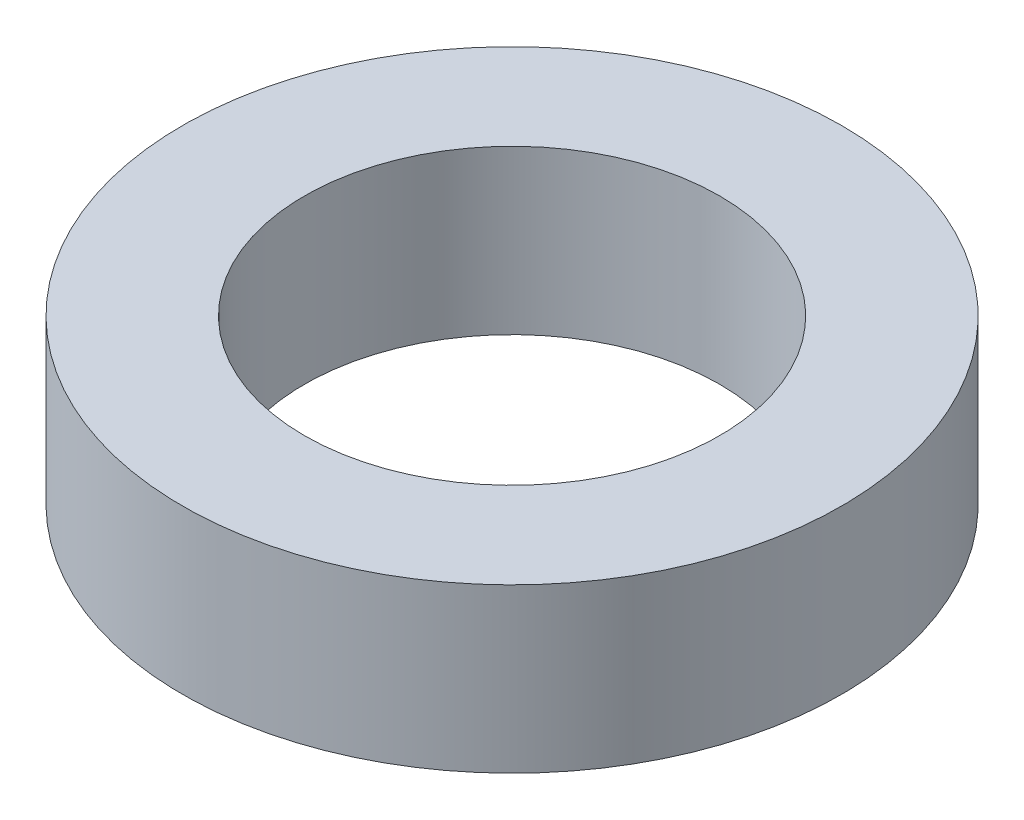
from build123d import *

# Parameters (mm, degrees)
SKETCH1_R           = 5
SKETCH1_R_2         = 3.15
BOSS_EXTRUDE1_DEPTH = 2.475


with BuildPart() as part:
    # Sketch1 → Boss-Extrude1 (new body)
    with BuildSketch(Plane(origin=(0, 0, 0), x_dir=(1, 0, 0), z_dir=(0, 1, 0))):
        with Locations(Location((0, 0, 0), (0, 0, 90))):
            Circle(SKETCH1_R)
        with Locations(Location((0, 0, 0), (0, 0, 90))):
            Circle(SKETCH1_R_2, mode=Mode.SUBTRACT)
    extrude(amount=BOSS_EXTRUDE1_DEPTH)


solid = part.part
